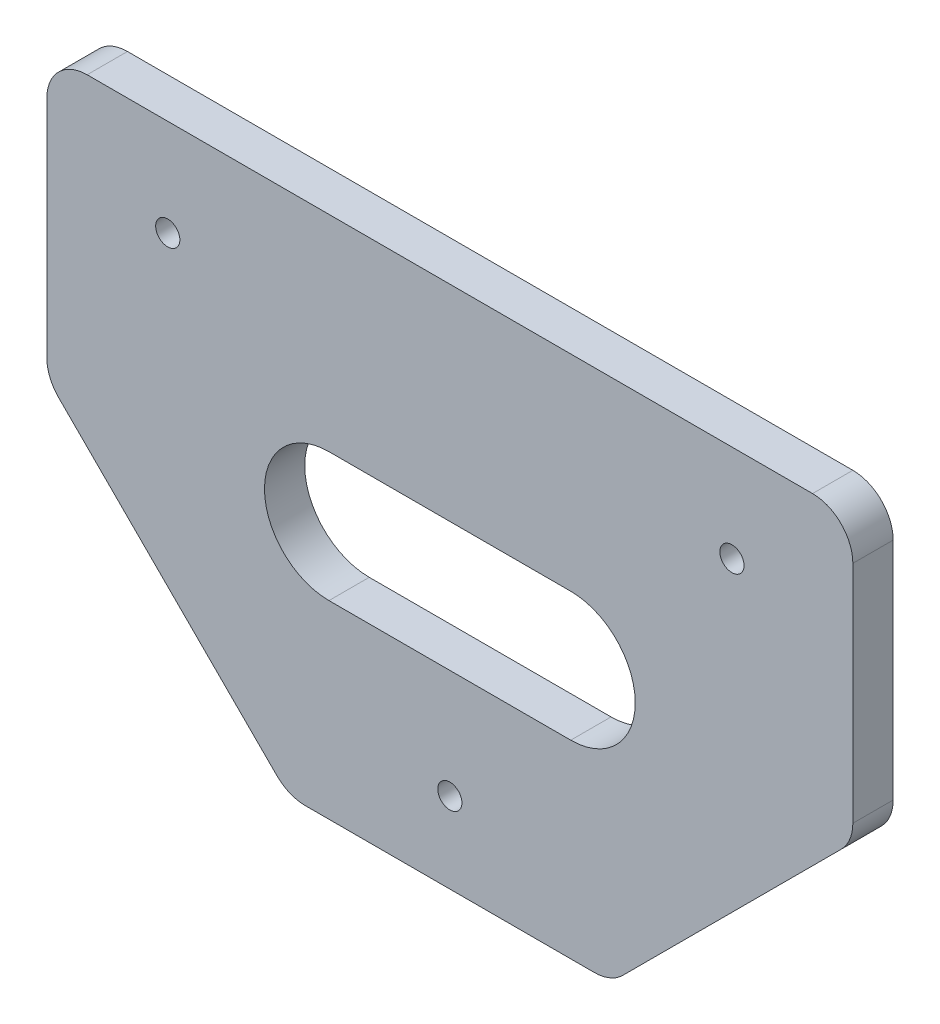
from build123d import *

# Parameters (mm, degrees)
BOSS_EXTRUDE1_DEPTH = 5
SKETCH3_R           = 1.5
CUT_EXTRUDE3_DEPTH  = 126.099960032
FILLET1_R           = 5
FILLET2_R           = 5
FILLET3_R           = 5
FILLET4_R           = 5
FILLET5_R           = 5
FILLET6_R           = 5


with BuildPart() as part:
    # Sketch1 → Boss-Extrude1 (new body)
    with BuildSketch(Plane.XY):
        Polygon((0, 40), (30, 10), (70, 10), (100, 40), (100, 75), (0, 75), align=None)
    extrude(amount=BOSS_EXTRUDE1_DEPTH)

    # Sketch3 → Cut-Extrude3 (cut, through all)
    with BuildSketch(Plane.XY.offset(5)):
        with Locations((50, 20)):
            Circle(SKETCH3_R)
        with Locations((85, 63)):
            Circle(SKETCH3_R)
        with Locations((15, 63)):
            Circle(SKETCH3_R)
        with BuildLine():
            Line((35, 49.5), (65, 49.5))
            ThreePointArc((65, 49.5), (73, 41.5), (65, 33.5))
            Line((65, 33.5), (35, 33.5))
            ThreePointArc((35, 33.5), (27, 41.5), (35, 49.5))
        make_face()
    extrude(amount=-CUT_EXTRUDE3_DEPTH, mode=Mode.SUBTRACT)

    # Fillet1
    fillet1_edges = [part.edges().sort_by_distance(p)[0] for p in [
        (0, 40, 2.5),
    ]]
    fillet(fillet1_edges, radius=FILLET1_R)

    # Fillet2
    fillet2_edges = [part.edges().sort_by_distance(p)[0] for p in [
        (100, 40, 2.5),
    ]]
    fillet(fillet2_edges, radius=FILLET2_R)

    # Fillet3
    fillet3_edges = [part.edges().sort_by_distance(p)[0] for p in [
        (70, 10, 2.5),
    ]]
    fillet(fillet3_edges, radius=FILLET3_R)

    # Fillet4
    fillet4_edges = [part.edges().sort_by_distance(p)[0] for p in [
        (30, 10, 2.5),
    ]]
    fillet(fillet4_edges, radius=FILLET4_R)

    # Fillet5
    fillet5_edges = [part.edges().sort_by_distance(p)[0] for p in [
        (100, 75, 2.5),
    ]]
    fillet(fillet5_edges, radius=FILLET5_R)

    # Fillet6
    fillet6_edges = [part.edges().sort_by_distance(p)[0] for p in [
        (0, 75, 2.5),
    ]]
    fillet(fillet6_edges, radius=FILLET6_R)


solid = part.part
